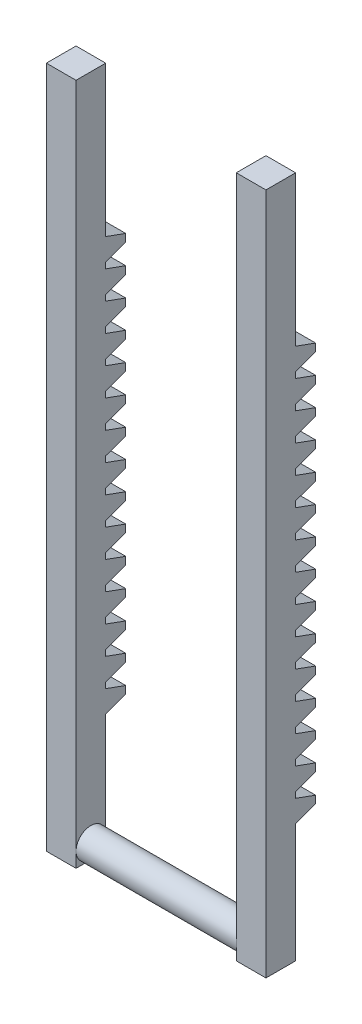
from build123d import *

# Parameters (mm, degrees)
SKETCH_1_W             = 5
SKETCH_1_H             = 5
EXTRUDE_2_DEPTH        = 115
EXTRUDE_2_2_DEPTH      = 115
SKETCH_2_R             = 2.5
EXTRUDE_3_DEPTH        = 27
EXTRUDE_5_DEPTH        = 5
PATTERN_LINEAR_1_COUNT = 15
PATTERN_LINEAR_1_PITCH = 4.71238898
EXTRUDE_6_DEPTH        = 5
PATTERN_LINEAR_2_COUNT = 15
PATTERN_LINEAR_2_PITCH = 4.712


with BuildPart() as part:
    # ｽｹｯﾁ1 → ﾎﾞｽ - 押し出し2 (new body)
    with BuildSketch(Plane(origin=(0, 0, 0), x_dir=(1, 0, 0), z_dir=(0, 1, 0))):
        with Locations((-18.035714286, 2.5)):
            Rectangle(SKETCH_1_W, SKETCH_1_H)
    extrude(amount=-EXTRUDE_2_DEPTH)



with BuildPart() as body_2:
    # ｽｹｯﾁ1 → Extrude 2 2 (new body)
    with BuildSketch(Plane(origin=(0, 0, 0), x_dir=(1, 0, 0), z_dir=(0, 1, 0))):
        with Locations((13.964285714, 2.5)):
            Rectangle(SKETCH_1_W, SKETCH_1_H)
    extrude(amount=-EXTRUDE_2_2_DEPTH)


with BuildPart() as part_1:
    add(part.part)

    add(body_2.part)  # ﾎﾞｽ - 押し出し3 merges body 2
    # ｽｹｯﾁ2 → ﾎﾞｽ - 押し出し3 (add)
    with BuildSketch(Plane(origin=(-15.535714286, 0, 0), x_dir=(0, 0, -1), z_dir=(1, 0, 0))):
        with Locations(Location((2.5, -112.5, 0), (0, 0, 180))):
            Circle(SKETCH_2_R)
    extrude(amount=EXTRUDE_3_DEPTH)

    # ｽｹｯﾁ3 → ﾎﾞｽ - 押し出し5 (add)
    with BuildSketch(Plane(origin=(16.464285714, 0, 0), x_dir=(0, 0, -1), z_dir=(1, 0, 0))):
        Polygon((5, -91.278917131), (8.375, -92.507316672), (8.375, -93.771600459), (5, -95), align=None)
    extrude_5 = extrude(amount=-EXTRUDE_5_DEPTH)

    # 直線ﾊﾟﾀｰﾝ1: ﾎﾞｽ - 押し出し5 ×15
    with Locations(*[(0, i * PATTERN_LINEAR_1_PITCH, 0) for i in range(1, PATTERN_LINEAR_1_COUNT)]):
        add(extrude_5)

    # ｽｹｯﾁ4 → ﾎﾞｽ - 押し出し6 (add)
    with BuildSketch(Plane.ZY.offset(20.535714286)):
        Polygon((-5, -25.305471406), (-8.375, -26.533870947), (-8.375, -27.798154734), (-5, -29.026554275), align=None)
    extrude_6 = extrude(amount=-EXTRUDE_6_DEPTH)

    # 直線ﾊﾟﾀｰﾝ2: ﾎﾞｽ - 押し出し6 ×15
    with Locations(*[(0, -i * PATTERN_LINEAR_2_PITCH, 0) for i in range(1, PATTERN_LINEAR_2_COUNT)]):
        add(extrude_6)


solid = part_1.part
